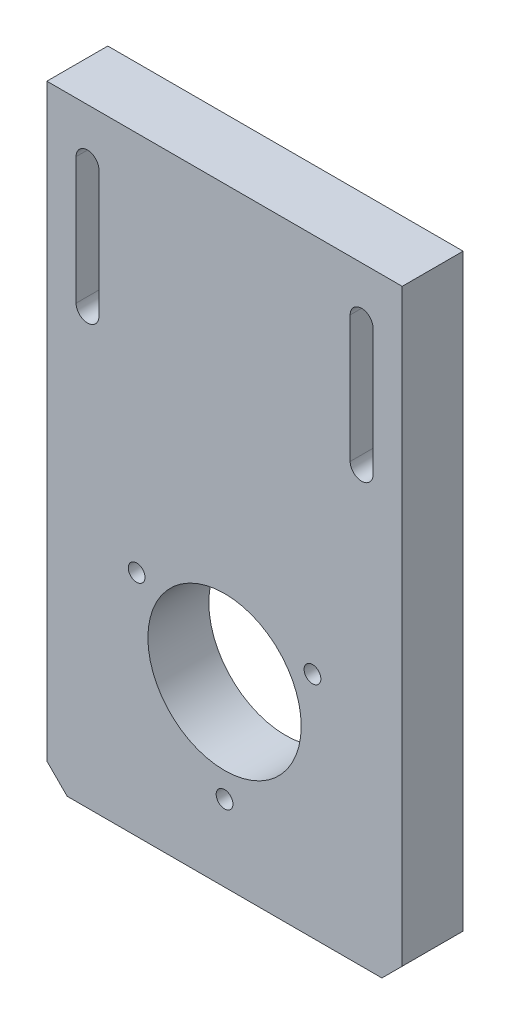
from build123d import *

# Parameters (mm, degrees)
EXTRUDE_1_DEPTH     = 12
SKETCH_2_R          = 15.1
CUT_EXTRUDE_1_DEPTH = 90.199215243
M4X0_7_1_D          = 3.3
CUT_EXTRUDE_2_DEPTH = 90.199215243


with BuildPart() as part:
    # 草图1 → 凸台-拉伸1 (new body)
    with BuildSketch(Plane.XY):
        Polygon((-38.5, -42.5), (23.5, -42.5), (27.5, -38.5), (27.5, 77.5), (-42.5, 77.5), (-42.5, -38.5), align=None)
    extrude(amount=EXTRUDE_1_DEPTH)

    # 草图2 → 切除-拉伸1 (cut, through all)
    with BuildSketch(Plane.XY.offset(12)):
        with Locations((-7.5, -7.5)):
            Circle(SKETCH_2_R)
    extrude(amount=-CUT_EXTRUDE_1_DEPTH, mode=Mode.SUBTRACT)

    # M4x0.7 螺纹孔1 (through all)
    with Locations(Plane.XY.offset(12)):
        with Locations((-7.5, -27.5), (-24.820508076, 2.5), (9.820508076, 2.5)):
            Hole(M4X0_7_1_D / 2)

    # 草图7 → 切除-拉伸2 (cut, through all)
    with BuildSketch(Plane.XY.offset(12)):
        with BuildLine():
            Line((-32.25, 67.5), (-32.25, 42.5))
            ThreePointArc((-32.25, 42.5), (-34.5, 40.25), (-36.75, 42.5))
            Line((-36.75, 42.5), (-36.75, 67.5))
            ThreePointArc((-36.75, 67.5), (-34.5, 69.75), (-32.25, 67.5))
        make_face()
        with BuildLine():
            Line((17.25, 67.5), (17.25, 42.5))
            ThreePointArc((17.25, 42.5), (19.5, 40.25), (21.75, 42.5))
            Line((21.75, 42.5), (21.75, 67.5))
            ThreePointArc((21.75, 67.5), (19.5, 69.75), (17.25, 67.5))
        make_face()
    extrude(amount=-CUT_EXTRUDE_2_DEPTH, mode=Mode.SUBTRACT)


solid = part.part
